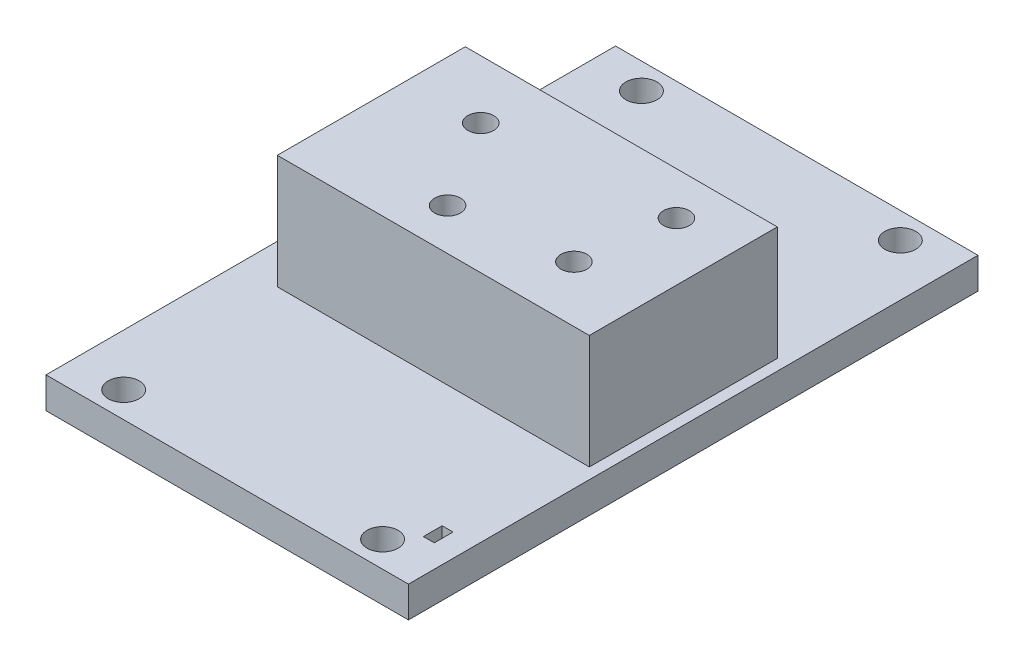
from build123d import *

# Parameters (mm, degrees)
SKETCH1_W           = 35
SKETCH1_H           = 55
SKETCH1_R           = 1.5
SKETCH1_R_2         = 1.25
SKETCH1_W_2         = 1.053264104
SKETCH1_H_2         = 1.810086697
BOSS_EXTRUDE1_DEPTH = 3
SKETCH2_W           = 30.130506089
SKETCH2_H           = 18.151203477
BOSS_EXTRUDE2_DEPTH = 11
SKETCH3_R           = 1.25
CUT_EXTRUDE1_DEPTH  = 35.402034824
SKETCH4_W           = 25.972666726
SKETCH4_H           = 17.735623468
CUT_EXTRUDE2_DEPTH  = 4


with BuildPart() as part:
    # Sketch1 → Boss-Extrude1 (new body)
    with BuildSketch(Plane(origin=(0, 0, 0), x_dir=(1, 0, 0), z_dir=(0, 1, 0))):
        Rectangle(SKETCH1_W, SKETCH1_H)
        with Locations(Location((12.5, 25, 0), (0, 0, 270))):
            Circle(SKETCH1_R, mode=Mode.SUBTRACT)
        with Locations(Location((-12.5, 25, 0), (0, 0, 270))):
            Circle(SKETCH1_R, mode=Mode.SUBTRACT)
        with Locations(Location((12.5, -25, 0), (0, 0, 270))):
            Circle(SKETCH1_R, mode=Mode.SUBTRACT)
        with Locations(Location((-12.5, -25, 0), (0, 0, 270))):
            Circle(SKETCH1_R, mode=Mode.SUBTRACT)
        with Locations(Location((-1.27, -4.95, 0), (0, 0, 90))):
            Circle(SKETCH1_R_2, mode=Mode.SUBTRACT)
        with Locations(Location((-6.57, 3.55, 0), (0, 0, 90))):
            Circle(SKETCH1_R_2, mode=Mode.SUBTRACT)
        with Locations(Location((10.83, 5.05, 0), (0, 0, 90))):
            Circle(SKETCH1_R_2, mode=Mode.SUBTRACT)
        with Locations(Location((9.53, -3.55, 0), (0, 0, 90))):
            Circle(SKETCH1_R_2, mode=Mode.SUBTRACT)
        with Locations((14.770586435, -21.896230663)):
            Rectangle(SKETCH1_W_2, SKETCH1_H_2, mode=Mode.SUBTRACT)
    extrude(amount=BOSS_EXTRUDE1_DEPTH)

    # Sketch2 → Boss-Extrude2 (add)
    with BuildSketch(Plane(origin=(0, 3, 0), x_dir=(1, 0, 0), z_dir=(0, 1, 0))):
        with Locations((1.371677436, 0.106547158)):
            Rectangle(SKETCH2_W, SKETCH2_H)
    extrude(amount=BOSS_EXTRUDE2_DEPTH)

    # Sketch3 → Cut-Extrude1 (cut, through all)
    with BuildSketch(Plane.XZ.offset(-3)):
        with Locations(Location((-1.27, 4.95, 0), (0, 0, 270))):
            Circle(SKETCH3_R)
        with Locations(Location((-6.57, -3.55, 0), (0, 0, 270))):
            Circle(SKETCH3_R)
        with Locations(Location((9.53, 3.55, 0), (0, 0, 270))):
            Circle(SKETCH3_R)
        with Locations(Location((10.83, -5.05, 0), (0, 0, 270))):
            Circle(SKETCH3_R)
    extrude(amount=-CUT_EXTRUDE1_DEPTH, mode=Mode.SUBTRACT)

    # Sketch4 → Cut-Extrude2 (cut)
    with BuildSketch(Plane.XZ):
        with Locations((1.214862274, -0.038232514)):
            Rectangle(SKETCH4_W, SKETCH4_H)
    extrude(amount=-CUT_EXTRUDE2_DEPTH, mode=Mode.SUBTRACT)


solid = part.part
